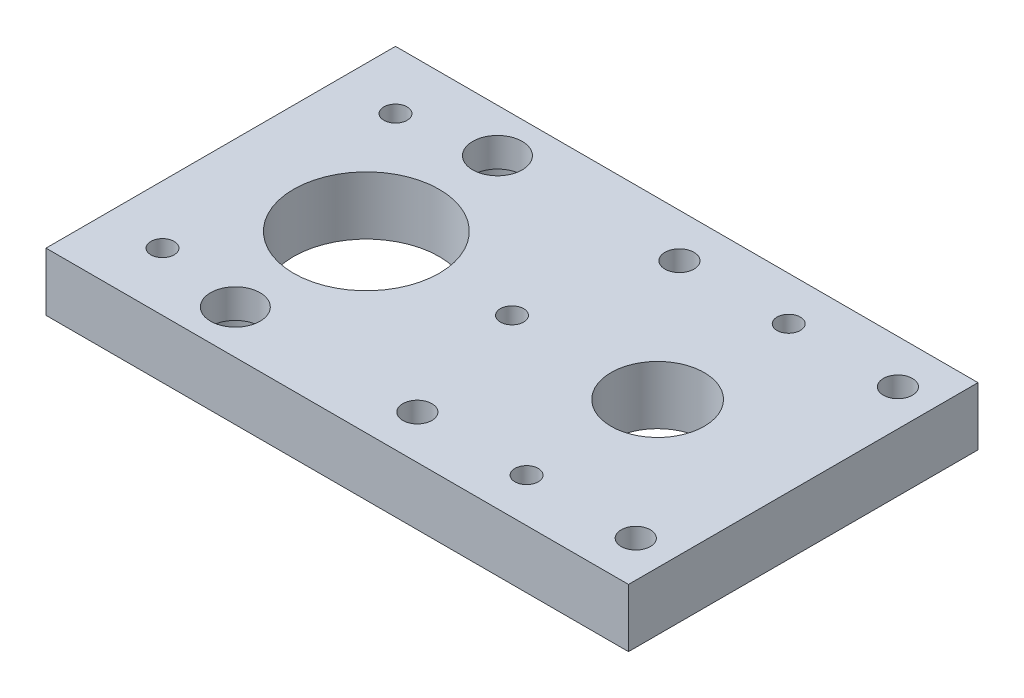
from build123d import *

# Parameters (mm, degrees)
SKETCH_1_W          = 20
SKETCH_1_H          = 12
SKETCH_1_R          = 2.5
SKETCH_1_R_2        = 1.6
EXTRUDE_1_DEPTH     = 2
SKETCH_1_4_R        = 0.5
SKETCH_1_4_R_2      = 0.85
CUT_EXTRUDE_1_DEPTH = 17.278820596
SKETCH_1_5_R        = 1
SKETCH_1_5_R_2      = 1.1
CUT_EXTRUDE_2_DEPTH = 1
SKETCH_2_R          = 0.4
CUT_EXTRUDE_3_DEPTH = 17.278820596


with BuildPart() as part:
    # 草图1 → 凸台-拉伸1 (new body)
    with BuildSketch(Plane(origin=(0, 0, 0), x_dir=(1, 0, 0), z_dir=(0, 1, 0))):
        with Locations((-5, 0)):
            Rectangle(SKETCH_1_W, SKETCH_1_H)
        with Locations(Location((-10, 0, 0), (0, 0, 270))):
            Circle(SKETCH_1_R, mode=Mode.SUBTRACT)
        with Locations(Location((0, 0, 0), (0, 0, 270))):
            Circle(SKETCH_1_R_2, mode=Mode.SUBTRACT)
    extrude(amount=EXTRUDE_1_DEPTH)

    # 草图1<4> → 切除-拉伸1 (cut, through all)
    with BuildSketch(Plane(origin=(0, 0, 0), x_dir=(1, 0, 0), z_dir=(0, 1, 0))):
        with Locations(Location((-3.75, 4.5, 0), (0, 0, 270))):
            Circle(SKETCH_1_4_R)
        with Locations(Location((3.75, -4.5, 0), (0, 0, 270))):
            Circle(SKETCH_1_4_R)
        with Locations(Location((3.75, 4.5, 0), (0, 0, 270))):
            Circle(SKETCH_1_4_R)
        with Locations(Location((-3.75, -4.5, 0), (0, 0, 270))):
            Circle(SKETCH_1_4_R)
        with Locations(Location((-10, 4.5, 0), (0, 0, 270))):
            Circle(SKETCH_1_4_R_2)
        with Locations(Location((-10, -4.5, 0), (0, 0, 270))):
            Circle(SKETCH_1_4_R_2)
    extrude(amount=CUT_EXTRUDE_1_DEPTH, mode=Mode.SUBTRACT)

    # 草图1<5> → 切除-拉伸2 (cut)
    with BuildSketch(Plane(origin=(0, 0, 0), x_dir=(1, 0, 0), z_dir=(0, 1, 0))):
        with Locations(Location((-3.75, 4.5, 0), (0, 0, 270))):
            Circle(SKETCH_1_5_R)
        with Locations(Location((3.75, 4.5, 0), (0, 0, 270))):
            Circle(SKETCH_1_5_R)
        with Locations(Location((-3.75, -4.5, 0), (0, 0, 270))):
            Circle(SKETCH_1_5_R)
        with Locations(Location((3.75, -4.5, 0), (0, 0, 270))):
            Circle(SKETCH_1_5_R)
        with Locations(Location((-10, -4.5, 0), (0, 0, 270))):
            Circle(SKETCH_1_5_R_2)
        with Locations(Location((-10, 4.5, 0), (0, 0, 270))):
            Circle(SKETCH_1_5_R_2)
    extrude(amount=CUT_EXTRUDE_2_DEPTH, mode=Mode.SUBTRACT)

    # 草图2 → 切除-拉伸3 (cut, through all)
    with BuildSketch(Plane.XZ):
        with Locations(Location((-13, 4, 0), (0, 0, 270))):
            Circle(SKETCH_2_R)
        with Locations(Location((-5, 0, 0), (0, 0, 270))):
            Circle(SKETCH_2_R)
        with Locations(Location((-13, -4, 0), (0, 0, 270))):
            Circle(SKETCH_2_R)
        with Locations(Location((0, -4.5, 0), (0, 0, 270))):
            Circle(SKETCH_2_R)
        with Locations(Location((0, 4.5, 0), (0, 0, 270))):
            Circle(SKETCH_2_R)
    extrude(amount=-CUT_EXTRUDE_3_DEPTH, mode=Mode.SUBTRACT)


solid = part.part
